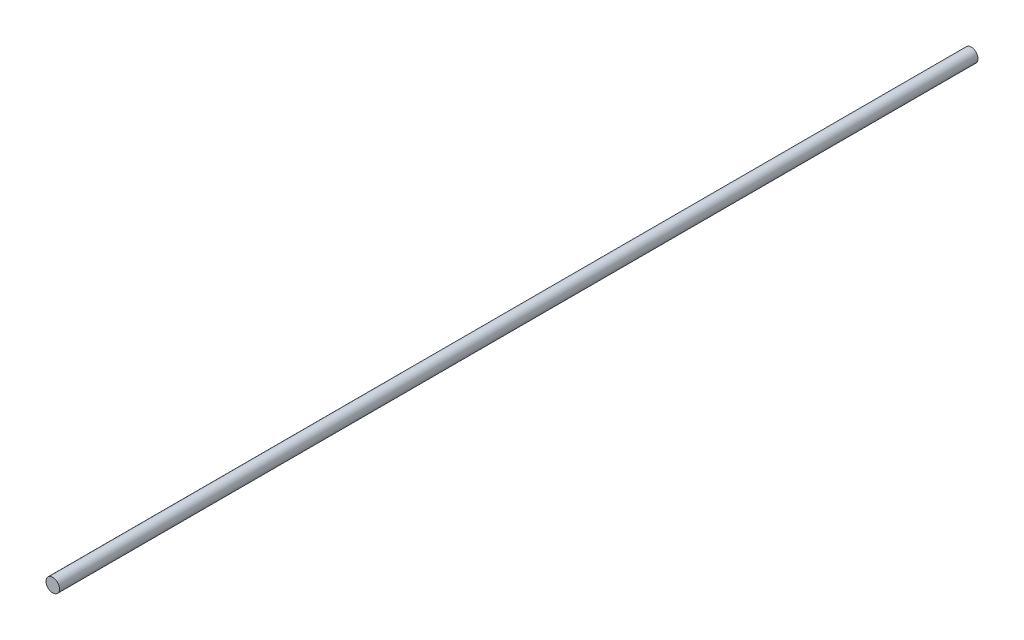
from build123d import *

# Parameters (mm, degrees)
SZKIC1_R                    = 2.5
DODANIE_WYCI_GNI_CIE1_DEPTH = 340


with BuildPart() as part:
    # Szkic1 → Dodanie-wyciągnięcie1 (new body)
    with BuildSketch(Plane.XY):
        Circle(SZKIC1_R)
    extrude(amount=DODANIE_WYCI_GNI_CIE1_DEPTH)


solid = part.part
